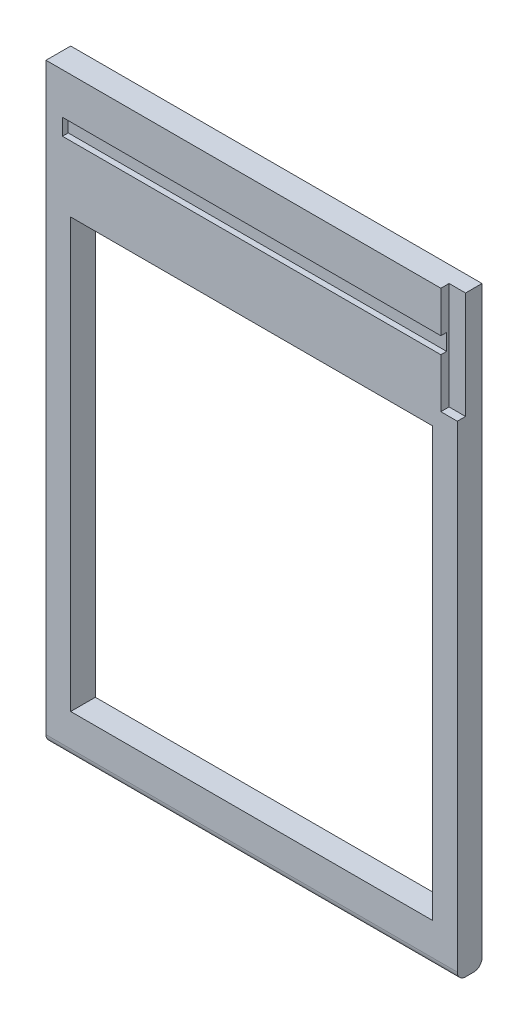
from build123d import *

# Parameters (mm, degrees)
CROQUIS2_W              = 500
CROQUIS2_H              = 720
SALIENTE_EXTRUIR1_DEPTH = 30
CROQUIS3_W              = 440
CROQUIS3_H              = 520.616152256
CORTAR_EXTRUIR1_DEPTH   = 440.31765273
REDONDEO1_R             = 10
REDONDEO2_R             = 10
CROQUIS4_W              = 440
CROQUIS4_H              = 90
CORTAR_EXTRUIR4_DEPTH   = 5
CROQUIS9_W              = 480
CROQUIS9_H              = 20
CORTAR_EXTRUIR6_DEPTH   = 7
CROQUIS10_W             = 10
CROQUIS10_H             = 130
CORTAR_EXTRUIR7_DEPTH   = 20


with BuildPart() as part:
    # Croquis2 → Saliente-Extruir1 (new body)
    with BuildSketch(Plane.XY):
        Rectangle(CROQUIS2_W, CROQUIS2_H)
    extrude(amount=SALIENTE_EXTRUIR1_DEPTH)

    # Croquis3 → Cortar-Extruir1 (cut, through all)
    with BuildSketch(Plane(origin=(0, 0, 0), x_dir=(-1, 0, 0), z_dir=(0, 0, -1))):
        with Locations((0, -50.308076128)):
            Rectangle(CROQUIS3_W, CROQUIS3_H)
    extrude(amount=-CORTAR_EXTRUIR1_DEPTH, mode=Mode.SUBTRACT)

    # Redondeo1
    redondeo1_edges = [part.edges().sort_by_distance(p)[0] for p in [
        (0, -360, 0),
    ]]
    fillet(redondeo1_edges, radius=REDONDEO1_R)

    # Redondeo2
    redondeo2_edges = [part.edges().sort_by_distance(p)[0] for p in [
        (0, -360, 30),
    ]]
    fillet(redondeo2_edges, radius=REDONDEO2_R)

    # Croquis4 → Cortar-Extruir4 (cut)
    with BuildSketch(Plane(origin=(0, 0, 0), x_dir=(-1, 0, 0), z_dir=(0, 0, -1))):
        with Locations((0, 284.028138346)):
            Rectangle(CROQUIS4_W, CROQUIS4_H)
    extrude(amount=-CORTAR_EXTRUIR4_DEPTH, mode=Mode.SUBTRACT)

    # Croquis9 → Cortar-Extruir6 (cut)
    with BuildSketch(Plane.XY.offset(30)):
        with Locations((10, 300)):
            Rectangle(CROQUIS9_W, CROQUIS9_H)
    extrude(amount=-CORTAR_EXTRUIR6_DEPTH, mode=Mode.SUBTRACT)

    # Croquis10 → Cortar-Extruir7 (cut)
    with BuildSketch(Plane(origin=(250, 0, 0), x_dir=(0, 0, -1), z_dir=(1, 0, 0))):
        with Locations((-25, 295)):
            Rectangle(CROQUIS10_W, CROQUIS10_H)
    extrude(amount=-CORTAR_EXTRUIR7_DEPTH, mode=Mode.SUBTRACT)


solid = part.part
